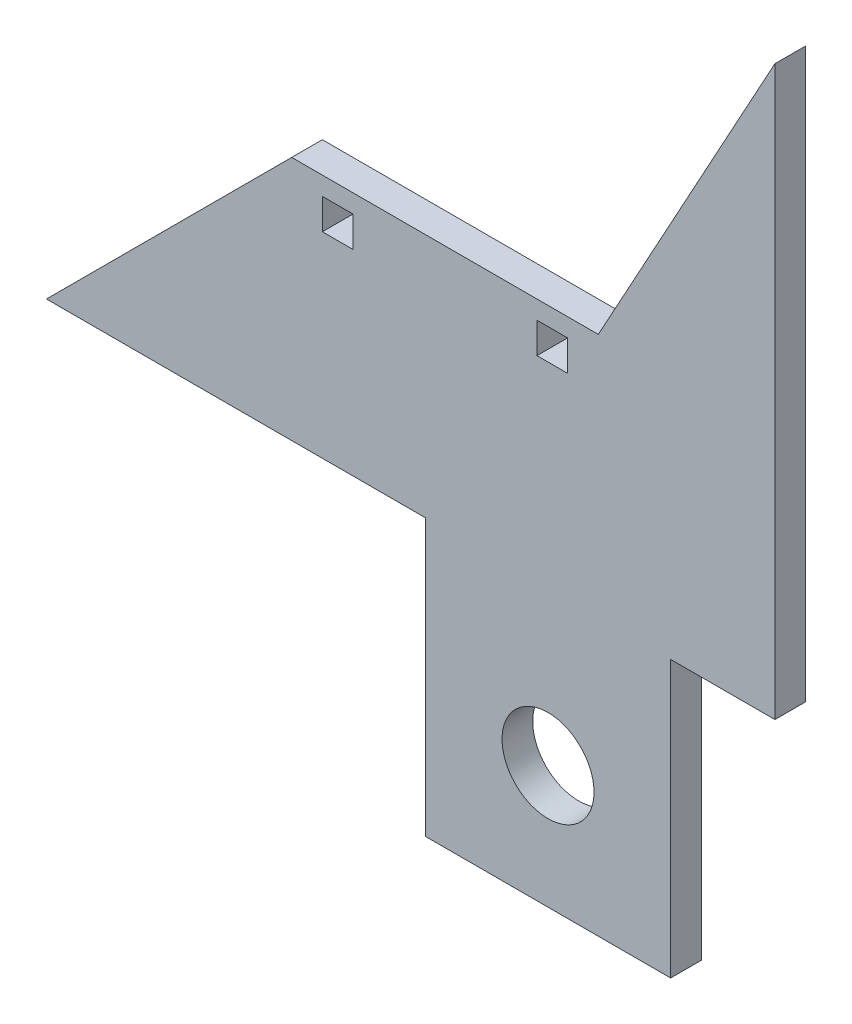
from build123d import *

# Parameters (mm, degrees)
BOSS_EXTRUDE1_DEPTH = 5
SKETCH3_W           = 5
SKETCH3_H           = 5
CUT_EXTRUDE1_DEPTH  = 5
SKETCH4_R           = 7.5
CUT_EXTRUDE2_DEPTH  = 10


with BuildPart() as part:
    # Sketch2 → Boss-Extrude1 (new body)
    with BuildSketch(Plane.XY):
        Polygon((-61.802768985, 20.649350649), (-11.802768985, 20.649350649), (17, 73.283944775), (17, -19.350649351), (0, -19.350649351), (0, -64.350649351), (-40, -64.350649351), (-40, -19.350649351), (-61.802768985, -19.350649351), (-101.802768985, -19.350649351), align=None)
    extrude(amount=BOSS_EXTRUDE1_DEPTH)

    # Sketch3 → Cut-Extrude1 (cut)
    with BuildSketch(Plane.XY.offset(5)):
        with Locations((-54.302768985, 15.149350649)):
            Rectangle(SKETCH3_W, SKETCH3_H)
        with Locations((-19.302768985, 15.149350649)):
            Rectangle(SKETCH3_W, SKETCH3_H)
    extrude(amount=-CUT_EXTRUDE1_DEPTH, mode=Mode.SUBTRACT)

    # Sketch4 → Cut-Extrude2 (cut)
    with BuildSketch(Plane.XY.offset(5)):
        with Locations((-20, -44.350649351)):
            Circle(SKETCH4_R)
    extrude(amount=-CUT_EXTRUDE2_DEPTH, mode=Mode.SUBTRACT)


solid = part.part
